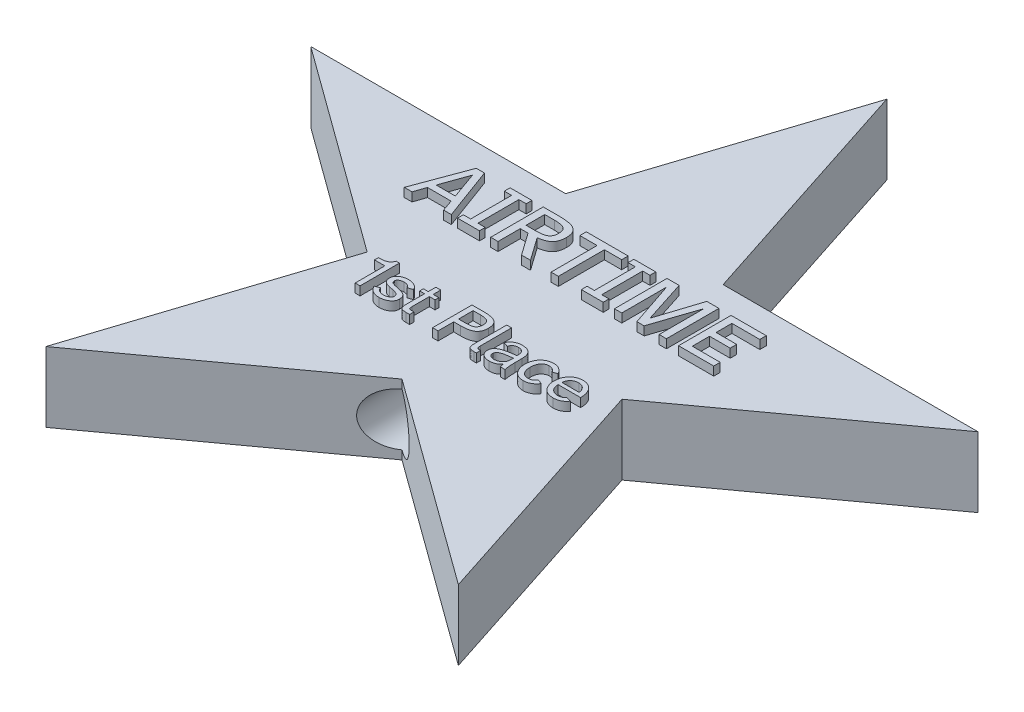
from build123d import *

# Parameters (mm, degrees)
BOSS_EXTRUDE1_DEPTH = 8
BOSS_EXTRUDE2_DEPTH = 1
SKETCH3_R           = 3
CUT_EXTRUDE1_DEPTH  = 9


with BuildPart() as part:
    # Sketch1 → Boss-Extrude1 (new body)
    with BuildSketch(Plane(origin=(0, 0, 0), x_dir=(1, 0, 0), z_dir=(0, 1, 0))):
        Polygon((0, 0), (8.994189943, -27.681270317), (38.1, -27.681270317), (14.552905029, -44.789236225), (23.547094971, -72.470506542), (0, -55.362540634), (-23.547094971, -72.470506542), (-14.552905029, -44.789236225), (-38.1, -27.681270317), (-8.994189943, -27.681270317), align=None)
    extrude(amount=BOSS_EXTRUDE1_DEPTH)

    # Sketch2 → Boss-Extrude2 (add)
    # profile 1 of 15: a face of its own
    with BuildSketch(Plane(origin=(0, 8, 0), x_dir=(1, 0, 0), z_dir=(0, 1, 0))):
        with BuildLine():
            Line((-11.174829705, -49.535377091), (-11.174829705, -46.144966133))
            Line((-11.174829705, -46.144966133), (-12.360510355, -46.144966133))
            Line((-12.360510355, -46.144966133), (-12.360510355, -45.713459283))
            add(Edge.make_bspline(
                [(-12.360510355, -45.713459283), (-12.308161509, -45.713003139), (-12.204976686, -45.712104033), (-12.052986102, -45.702056451), (-11.906478904, -45.68662452), (-11.765564563, -45.666458948), (-11.631775272, -45.63628777), (-11.506452769, -45.59413246), (-11.390850601, -45.538548722), (-11.283941391, -45.471490084), (-11.187453214, -45.388532311), (-11.105415156, -45.287512662), (-11.037799116, -45.168409523), (-11.005647688, -45.08087732), (-10.988935013, -45.035377091)],
                knots=[0, 0, 0, 0, 1.139246389, 2.245568783, 3.313622096, 4.345396522, 5.342144491, 6.294599133, 7.21665216, 8.127783474, 9.034320752, 9.972934293, 10.94630834, 12, 12, 12, 12], degree=3))
            Line((-10.988935013, -45.035377091), (-10.616182444, -45.035377091))
            Line((-10.616182444, -45.035377091), (-10.616182444, -49.535377091))
            Line((-10.616182444, -49.535377091), (-11.174829705, -49.535377091))
        make_face()
    # profile 2 of 15: a face of its own
    with BuildSketch(Plane(origin=(0, 8, 0), x_dir=(1, 0, 0), z_dir=(0, 1, 0))):
        with BuildLine():
            add(Edge.make_bspline(
                [(-8.397967547, -49.597020927), (-8.445544966, -49.59595662), (-8.540373404, -49.593835308), (-8.681933073, -49.575190466), (-8.822674687, -49.548176123), (-8.961055524, -49.507217459), (-9.095363811, -49.456304848), (-9.222653937, -49.391562625), (-9.343137054, -49.316920405), (-9.455415797, -49.230105866), (-9.557632527, -49.130699983), (-9.64556909, -49.017172684), (-9.723723301, -48.892893885), (-9.762996216, -48.802345132), (-9.783027479, -48.756160482)],
                knots=[0, 0, 0, 0, 0.994156079, 1.98149189, 2.980552278, 3.987315913, 4.994437444, 5.978963288, 6.967871926, 7.953289602, 8.940488527, 9.939458731, 10.949015058, 12, 12, 12, 12], degree=3))
            Line((-9.783027479, -48.756160482), (-9.243643917, -48.558707571))
            add(Edge.make_bspline(
                [(-9.243643917, -48.558707571), (-9.236950342, -48.581938184), (-9.223834399, -48.627458167), (-9.19823371, -48.692589177), (-9.164855244, -48.751497359), (-9.126859964, -48.805754726), (-9.084865123, -48.856678569), (-9.035325075, -48.900651485), (-8.980498864, -48.93961513), (-8.901427224, -48.98508551), (-8.796367378, -49.03111231), (-8.665939489, -49.070310332), (-8.532848753, -49.095918063), (-8.443031432, -49.098647878), (-8.397967547, -49.100017502)],
                knots=[0, 0, 0, 0, 0.801801301, 1.571115721, 2.314867836, 3.041651161, 3.767106742, 4.49855696, 5.231478833, 5.995021649, 7.520806921, 9.023408482, 10.506560037, 12, 12, 12, 12], degree=3))
            add(Edge.make_bspline(
                [(-8.397967547, -49.100017502), (-8.365179397, -49.099321522), (-8.300359145, -49.09794561), (-8.204799055, -49.085660307), (-8.111858483, -49.067872256), (-8.0227671, -49.041568807), (-7.938144426, -49.010071706), (-7.861827577, -48.968839574), (-7.792580455, -48.922646972), (-7.731931545, -48.869995972), (-7.68130817, -48.811976892), (-7.644857469, -48.748255235), (-7.622303576, -48.68028002), (-7.619940082, -48.633362161), (-7.618750938, -48.609756372)],
                knots=[0, 0, 0, 0, 1.166215785, 2.305540319, 3.423586646, 4.529956083, 5.607760748, 6.629936852, 7.609068202, 8.564517993, 9.480277891, 10.334766518, 11.162170873, 12, 12, 12, 12], degree=3))
            add(Edge.make_bspline(
                [(-7.618750938, -48.609756372), (-7.619647922, -48.587905291), (-7.621384889, -48.545591751), (-7.630239684, -48.484412229), (-7.648627119, -48.428877484), (-7.670840897, -48.377117201), (-7.702585731, -48.331373463), (-7.740491335, -48.290875245), (-7.784449257, -48.254239611), (-7.854205752, -48.213853147), (-7.950526905, -48.170341976), (-8.074815573, -48.123917204), (-8.209132304, -48.083146836), (-8.303400156, -48.063241608), (-8.35173467, -48.053035482)],
                knots=[0, 0, 0, 0, 0.777695943, 1.505969746, 2.188414266, 2.85266215, 3.501825056, 4.156187747, 4.821318092, 5.528156684, 7.014512829, 8.575258919, 10.244012182, 12, 12, 12, 12], degree=3))
            Line((-8.35173467, -48.053035482), (-8.811173883, -47.960569728))
            add(Edge.make_bspline(
                [(-8.811173883, -47.960569728), (-8.888751615, -47.941107631), (-9.041162674, -47.902871932), (-9.222201042, -47.830825254), (-9.355879539, -47.761286099), (-9.444468251, -47.696382424), (-9.523563083, -47.622168922), (-9.593785601, -47.537720234), (-9.649413663, -47.438804867), (-9.688604042, -47.325018226), (-9.712954779, -47.196830804), (-9.715327255, -47.106341516), (-9.716567718, -47.059028633)],
                knots=[0, 0, 0, 0, 1.701757288, 3.34331286, 4.135591178, 4.904151441, 5.673198097, 6.440936875, 7.233834425, 8.074989054, 8.99349613, 10, 10, 10, 10], degree=3))
            add(Edge.make_bspline(
                [(-9.716567718, -47.059028633), (-9.714479464, -47.011291211), (-9.710412675, -46.918324559), (-9.674732338, -46.784634236), (-9.615147872, -46.663447387), (-9.532456241, -46.555539903), (-9.431868604, -46.461273457), (-9.318108569, -46.377921799), (-9.191969186, -46.305963185), (-9.053745021, -46.248431749), (-8.907601326, -46.202507894), (-8.756599254, -46.168469477), (-8.601385936, -46.149076847), (-8.496906424, -46.1463445), (-8.444200424, -46.144966133)],
                knots=[0, 0, 0, 0, 0.986082631, 1.920355097, 2.838077393, 3.762503024, 4.716048575, 5.680356002, 6.673746349, 7.712303261, 8.770859532, 9.839079018, 10.909896327, 12, 12, 12, 12], degree=3))
            add(Edge.make_bspline(
                [(-8.444200424, -46.144966133), (-8.379522925, -46.146871377), (-8.251247121, -46.150650076), (-8.061872682, -46.185018833), (-7.878152741, -46.239170974), (-7.730252818, -46.300693438), (-7.618945613, -46.362297764), (-7.53969859, -46.413160816), (-7.468230062, -46.471860723), (-7.402525045, -46.536142163), (-7.344326912, -46.606744582), (-7.290188951, -46.682265789), (-7.244377287, -46.764973637), (-7.219186901, -46.823466008), (-7.206507787, -46.852907057)],
                knots=[0, 0, 0, 0, 1.535739834, 3.04585466, 4.557029019, 6.081700382, 6.839748514, 7.578234075, 8.315773264, 9.033271986, 9.759037792, 10.48716551, 11.238542828, 12, 12, 12, 12], degree=3))
            Line((-7.206507787, -46.852907057), (-7.732406759, -47.041691304))
            add(Edge.make_bspline(
                [(-7.732406759, -47.041691304), (-7.748067318, -47.009065705), (-7.77917335, -46.944262596), (-7.850064158, -46.861790144), (-7.935476276, -46.79193182), (-8.035629122, -46.737740588), (-8.1433185, -46.695190961), (-8.254986817, -46.664026191), (-8.369061968, -46.645088193), (-8.446055984, -46.643010922), (-8.484654191, -46.641969557)],
                knots=[0, 0, 0, 0, 0.960714165, 1.908233609, 2.868947774, 3.887714533, 4.928304077, 5.949546492, 6.972078174, 8, 8, 8, 8], degree=3))
            add(Edge.make_bspline(
                [(-8.484654191, -46.641969557), (-8.525836045, -46.643177094), (-8.607159126, -46.645561653), (-8.726107975, -46.667109928), (-8.838738562, -46.703425197), (-8.927410444, -46.743427447), (-8.991874189, -46.783215457), (-9.034529947, -46.815428573), (-9.070081544, -46.851938754), (-9.098614061, -46.891519387), (-9.122740915, -46.933412224), (-9.138993474, -46.979391259), (-9.148788068, -47.028427225), (-9.149735992, -47.062193435), (-9.150214979, -47.079255516)],
                knots=[0, 0, 0, 0, 1.6769955, 3.311614902, 4.904450013, 6.490609702, 7.260226023, 7.98765938, 8.662998763, 9.327609681, 9.971822468, 10.625659759, 11.305545232, 12, 12, 12, 12], degree=3))
            add(Edge.make_bspline(
                [(-9.150214979, -47.079255516), (-9.148570089, -47.112343042), (-9.145406759, -47.175974522), (-9.110092804, -47.263707372), (-9.052490608, -47.336533385), (-8.972729506, -47.391503021), (-8.878518179, -47.434693886), (-8.774733221, -47.475390257), (-8.66013608, -47.510369135), (-8.579516405, -47.527742034), (-8.537629362, -47.536768359)],
                knots=[0, 0, 0, 0, 0.945115556, 1.817576251, 2.663565628, 3.573872339, 4.566850153, 5.634378768, 6.770909505, 8, 8, 8, 8], degree=3))
            Line((-8.537629362, -47.536768359), (-8.105159328, -47.622491817))
            add(Edge.make_bspline(
                [(-8.105159328, -47.622491817), (-8.01803482, -47.642339291), (-7.846115265, -47.681503572), (-7.639083982, -47.754232983), (-7.48463969, -47.827592604), (-7.379467469, -47.895210969), (-7.286641723, -47.97639112), (-7.202756746, -48.068277214), (-7.133618833, -48.177446702), (-7.087024118, -48.307518109), (-7.058108414, -48.45565078), (-7.054995503, -48.5611283), (-7.053361383, -48.616498667)],
                knots=[0, 0, 0, 0, 1.671257582, 3.29783049, 4.093133794, 4.866324071, 5.628726266, 6.394552882, 7.188016123, 8.028269759, 8.964941289, 10, 10, 10, 10], degree=3))
            add(Edge.make_bspline(
                [(-7.053361383, -48.616498667), (-7.055828454, -48.666469061), (-7.060653683, -48.76420384), (-7.096729837, -48.905146803), (-7.158919366, -49.033991263), (-7.244837043, -49.149214749), (-7.348343565, -49.252290751), (-7.467510598, -49.342247826), (-7.599996138, -49.420797017), (-7.746126764, -49.48459849), (-7.901427486, -49.533533452), (-8.062266509, -49.571121169), (-8.228532457, -49.592133491), (-8.341084729, -49.595380115), (-8.397967547, -49.597020927)],
                knots=[0, 0, 0, 0, 0.972455258, 1.901980206, 2.81077439, 3.74111896, 4.687169997, 5.646249121, 6.641272731, 7.679793655, 8.743508139, 9.808177582, 10.892274379, 12, 12, 12, 12], degree=3))
        make_face()
    # profile 3 of 15: a face of its own
    with BuildSketch(Plane(origin=(0, 8, 0), x_dir=(1, 0, 0), z_dir=(0, 1, 0))):
        with BuildLine():
            add(Edge.make_bspline(
                [(-5.373566862, -49.535377091), (-5.422726649, -49.534860609), (-5.515448484, -49.533886454), (-5.645417548, -49.520979952), (-5.758231056, -49.502793345), (-5.854552986, -49.475752561), (-5.936429833, -49.435975913), (-6.002036623, -49.379092199), (-6.055757056, -49.309031799), (-6.094317977, -49.222154133), (-6.119904839, -49.118058991), (-6.140034152, -48.99603259), (-6.150825604, -48.853631169), (-6.152103104, -48.75232353), (-6.152783472, -48.698369386)],
                knots=[0, 0, 0, 0, 1.288655415, 2.430573876, 3.421670372, 4.282171067, 5.046558095, 5.787205262, 6.538260159, 7.344488368, 8.259451436, 9.343274172, 10.585088262, 12, 12, 12, 12], degree=3))
            Line((-6.152783472, -48.698369386), (-6.152783472, -46.638116817))
            Line((-6.152783472, -46.638116817), (-6.712393917, -46.638116817))
            Line((-6.712393917, -46.638116817), (-6.712393917, -46.206609968))
            Line((-6.712393917, -46.206609968), (-6.152783472, -46.206609968))
            Line((-6.152783472, -46.206609968), (-6.152783472, -45.343596269))
            Line((-6.152783472, -45.343596269), (-5.594136212, -45.343596269))
            Line((-5.594136212, -45.343596269), (-5.594136212, -46.206609968))
            Line((-5.594136212, -46.206609968), (-4.954581417, -46.206609968))
            Line((-4.954581417, -46.206609968), (-4.954581417, -46.638116817))
            Line((-4.954581417, -46.638116817), (-5.594136212, -46.638116817))
            Line((-5.594136212, -46.638116817), (-5.594136212, -48.605903633))
            add(Edge.make_bspline(
                [(-5.594136212, -48.605903633), (-5.593802052, -48.645090701), (-5.593192709, -48.716548766), (-5.583814951, -48.813650986), (-5.569418421, -48.890076315), (-5.548746476, -48.95099612), (-5.506170955, -48.995618141), (-5.440747156, -49.020377936), (-5.355082905, -49.035830419), (-5.290197503, -49.03746507), (-5.254131931, -49.038373667)],
                knots=[0, 0, 0, 0, 1.413881225, 2.57822847, 3.512080928, 4.224200316, 4.863411193, 5.662151756, 6.70054228, 8, 8, 8, 8], degree=3))
            Line((-5.254131931, -49.038373667), (-4.954581417, -49.038373667))
            Line((-4.954581417, -49.038373667), (-4.954581417, -49.535377091))
            Line((-4.954581417, -49.535377091), (-5.373566862, -49.535377091))
        make_face()
    # profile 4 of 15: a face of its own
    with BuildSketch(Plane(origin=(0, 8, 0), x_dir=(1, 0, 0), z_dir=(0, 1, 0))):
        with BuildLine():
            Line((-2.332792033, -49.535377091), (-2.332792033, -45.035377091))
            Line((-2.332792033, -45.035377091), (-0.940989807, -45.035377091))
            add(Edge.make_bspline(
                [(-0.940989807, -45.035377091), (-0.852657021, -45.0365871), (-0.681204875, -45.038935702), (-0.431909405, -45.059454531), (-0.198894621, -45.092603087), (-0.015547823, -45.131779257), (0.12163487, -45.171446467), (0.217439785, -45.207466591), (0.307943729, -45.248303142), (0.392313529, -45.296255462), (0.471859581, -45.34887086), (0.544707738, -45.408976292), (0.612645368, -45.473699491), (0.675129211, -45.544272876), (0.730015761, -45.622932832), (0.778790062, -45.709083068), (0.818639681, -45.804083888), (0.852774432, -45.906663745), (0.878466324, -46.017938511), (0.896497072, -46.137405708), (0.906995016, -46.265176427), (0.908508112, -46.352994335), (0.909288446, -46.398283769)],
                knots=[0, 0, 0, 0, 1.998170982, 3.878409339, 5.654519698, 7.32006789, 8.115304635, 8.882994645, 9.633833201, 10.359115171, 11.076313613, 11.788751224, 12.492583165, 13.197763157, 13.917201874, 14.658706732, 15.43317091, 16.244012003, 17.10205423, 18.013268002, 18.975402947, 20, 20, 20, 20], degree=3))
            add(Edge.make_bspline(
                [(0.909288446, -46.398283769), (0.908500524, -46.442930884), (0.906967723, -46.529786102), (0.896502233, -46.656277228), (0.878462584, -46.774781499), (0.852805, -46.885110616), (0.818456863, -46.986968607), (0.778759696, -47.081677254), (0.73031614, -47.167747996), (0.674813611, -47.245654932), (0.61264048, -47.316098844), (0.545014294, -47.380910698), (0.471532601, -47.43991512), (0.392324252, -47.492584868), (0.308179776, -47.540778066), (0.217165983, -47.58012419), (0.121827197, -47.616738737), (-0.015676182, -47.654646073), (-0.199026755, -47.692159929), (-0.431932123, -47.724691131), (-0.681250418, -47.743857951), (-0.852663859, -47.746397354), (-0.940989807, -47.747705859)],
                knots=[0, 0, 0, 0, 1.013270556, 1.971187542, 2.878081656, 3.73174582, 4.538235693, 5.31514962, 6.058999971, 6.774767557, 7.482178142, 8.188236411, 8.8983439, 9.617810951, 10.345387099, 11.095598754, 11.865717084, 12.661436707, 14.329199759, 16.109899821, 17.995508498, 20, 20, 20, 20], degree=3))
            Line((-0.940989807, -47.747705859), (-1.706721828, -47.747705859))
            Line((-1.706721828, -47.747705859), (-1.706721828, -49.535377091))
            Line((-1.706721828, -49.535377091), (-2.332792033, -49.535377091))
        make_face()
        with BuildLine():
            Line((-1.706721828, -47.192911338), (-0.888014636, -47.192911338))
            add(Edge.make_bspline(
                [(-0.888014636, -47.192911338), (-0.835020209, -47.19249754), (-0.73150695, -47.191689275), (-0.580864581, -47.181339681), (-0.438372178, -47.167461628), (-0.304783655, -47.147137026), (-0.180097088, -47.117068347), (-0.068039487, -47.068502906), (0.030683526, -47.003778439), (0.103069071, -46.937841005), (0.15171886, -46.875197075), (0.183537691, -46.821763235), (0.210724608, -46.762376541), (0.232578124, -46.696755368), (0.24974964, -46.625203946), (0.262521731, -46.547658596), (0.268599641, -46.463876184), (0.269983024, -46.405996104), (0.270696836, -46.376130516)],
                knots=[0, 0, 0, 0, 1.542357721, 3.012665393, 4.393672929, 5.708948697, 6.944364447, 8.11635665, 9.243983313, 10.368157595, 10.94768979, 11.547151626, 12.1744538, 12.845356387, 13.557132473, 14.314626175, 15.130362646, 16, 16, 16, 16], degree=3))
            add(Edge.make_bspline(
                [(0.270696836, -46.376130516), (0.269995661, -46.345621797), (0.268643248, -46.286777226), (0.262429891, -46.201410714), (0.249850192, -46.122556103), (0.232602672, -46.049725154), (0.210496179, -45.982938937), (0.183746793, -45.922101753), (0.152019887, -45.867546037), (0.102375429, -45.804536546), (0.031291487, -45.735830751), (-0.068201275, -45.669572404), (-0.179803393, -45.617793166), (-0.304649585, -45.584801741), (-0.438297345, -45.561832313), (-0.580669379, -45.543995018), (-0.731542441, -45.535045556), (-0.835030029, -45.533282952), (-0.888014636, -45.532380516)],
                knots=[0, 0, 0, 0, 0.880295361, 1.697895032, 2.466835131, 3.181183989, 3.854805901, 4.493322626, 5.095329883, 5.669626875, 6.80276999, 7.930449582, 9.103210027, 10.334696088, 11.642721789, 13.014353096, 14.471378748, 16, 16, 16, 16], degree=3))
            Line((-0.888014636, -45.532380516), (-1.706721828, -45.532380516))
            Line((-1.706721828, -45.532380516), (-1.706721828, -47.192911338))
        make_face(mode=Mode.SUBTRACT)
    # profile 5 of 15: a face of its own
    with BuildSketch(Plane(origin=(0, 8, 0), x_dir=(1, 0, 0), z_dir=(0, 1, 0))):
        with BuildLine():
            add(Edge.make_bspline(
                [(2.413783309, -49.535377091), (2.364623522, -49.534860608), (2.271901689, -49.533886454), (2.141932618, -49.520979953), (2.029119131, -49.502793343), (1.932797138, -49.475752569), (1.850920492, -49.435975889), (1.785312989, -49.379092287), (1.731595305, -49.309031455), (1.69302285, -49.222155602), (1.66756415, -49.118360464), (1.64714728, -48.996377125), (1.636590317, -48.853944436), (1.635268469, -48.752321192), (1.634566699, -48.698369386)],
                knots=[0, 0, 0, 0, 1.288646185, 2.430556468, 3.421645865, 4.282140396, 5.04652195, 5.787163812, 6.53821333, 7.344435764, 8.259392279, 9.33490128, 10.585098396, 12, 12, 12, 12], degree=3))
            Line((1.634566699, -48.698369386), (1.634566699, -45.035377091))
            Line((1.634566699, -45.035377091), (2.19321396, -45.035377091))
            Line((2.19321396, -45.035377091), (2.19321396, -48.605903633))
            add(Edge.make_bspline(
                [(2.19321396, -48.605903633), (2.193474462, -48.645092108), (2.193951835, -48.716905485), (2.204205679, -48.814095083), (2.219940435, -48.890416342), (2.241440731, -48.951569947), (2.285981787, -48.995013367), (2.350676553, -49.020254125), (2.434857729, -49.03581186), (2.498127615, -49.037459729), (2.533218241, -49.038373667)],
                knots=[0, 0, 0, 0, 1.419752706, 2.60171477, 3.530453528, 4.249964349, 4.908071485, 5.710129009, 6.729996026, 8, 8, 8, 8], degree=3))
            Line((2.533218241, -49.038373667), (2.659395467, -49.038373667))
            Line((2.659395467, -49.038373667), (2.659395467, -49.535377091))
            Line((2.659395467, -49.535377091), (2.413783309, -49.535377091))
        make_face()
    # profile 6 of 15: a face of its own
    with BuildSketch(Plane(origin=(0, 8, 0), x_dir=(1, 0, 0), z_dir=(0, 1, 0))):
        with BuildLine():
            add(Edge.make_bspline(
                [(4.162927145, -49.597020927), (4.11180129, -49.595851332), (4.011338911, -49.593553076), (3.863816004, -49.571649682), (3.723067261, -49.536225032), (3.589926273, -49.487106582), (3.466275264, -49.425699215), (3.356726098, -49.347859808), (3.258177036, -49.260611437), (3.174838079, -49.159252089), (3.106275656, -49.046731871), (3.059540206, -48.921129597), (3.029441983, -48.785836145), (3.026139633, -48.691795386), (3.024442556, -48.643467845)],
                knots=[0, 0, 0, 0, 1.104760205, 2.170855402, 3.216345247, 4.237588551, 5.234092185, 6.191157297, 7.134837643, 8.071599606, 9.018007689, 9.969392091, 10.956470702, 12, 12, 12, 12], degree=3))
            add(Edge.make_bspline(
                [(3.024442556, -48.643467845), (3.024953249, -48.611620046), (3.025953792, -48.549224302), (3.040541454, -48.458422935), (3.060693111, -48.372075956), (3.092180842, -48.291921007), (3.131151709, -48.216636007), (3.178244709, -48.146185512), (3.234536803, -48.081148553), (3.30003393, -48.022449784), (3.372751968, -47.967388377), (3.45285935, -47.915749248), (3.539655715, -47.866130248), (3.634399519, -47.82149953), (3.73541402, -47.77879153), (3.843704459, -47.740682673), (3.958668656, -47.704809487), (4.12472548, -47.660914153), (4.347127012, -47.611782053), (4.630621103, -47.5603366), (4.935034566, -47.513654709), (5.145604647, -47.489506448), (5.254215672, -47.477050893)],
                knots=[0, 0, 0, 0, 0.692711089, 1.357149466, 1.998110463, 2.62002875, 3.226669239, 3.841354064, 4.460910029, 5.094392093, 5.7529932, 6.445280785, 7.168508277, 7.928384484, 8.724327543, 9.555801915, 10.427063312, 11.346236688, 13.295126237, 15.38497512, 17.619592573, 20, 20, 20, 20], degree=3))
            add(Edge.make_bspline(
                [(5.254215672, -47.477050893), (5.25463838, -47.442049834), (5.255461204, -47.373918312), (5.24966321, -47.274808638), (5.238129142, -47.181820804), (5.221401736, -47.094931245), (5.196919022, -47.014495453), (5.167359612, -46.94015584), (5.131519548, -46.871793619), (5.089017198, -46.810181304), (5.04087239, -46.754482713), (4.984935221, -46.706663348), (4.922320574, -46.666359304), (4.852679276, -46.633249203), (4.776435977, -46.607306813), (4.693071582, -46.58921058), (4.603048149, -46.578761161), (4.540844781, -46.577252405), (4.508710535, -46.576472982)],
                knots=[0, 0, 0, 0, 1.24604958, 2.425505346, 3.531484011, 4.580707499, 5.571640793, 6.5205364, 7.425660148, 8.313509929, 9.18028214, 10.039558866, 10.924238402, 11.824149428, 12.778537965, 13.785366975, 14.855921082, 16, 16, 16, 16], degree=3))
            add(Edge.make_bspline(
                [(4.508710535, -46.576472982), (4.461054822, -46.577915407), (4.369400745, -46.580689559), (4.238558305, -46.608033113), (4.121186734, -46.653426799), (4.018201947, -46.716532253), (3.930222531, -46.794695859), (3.860971392, -46.889030343), (3.806444004, -46.995480446), (3.786743343, -47.073908108), (3.776689987, -47.113930174)],
                knots=[0, 0, 0, 0, 1.152519454, 2.216588533, 3.218332585, 4.184836951, 5.126004245, 6.047875634, 7.003820228, 8, 8, 8, 8], degree=3))
            Line((3.776689987, -47.113930174), (3.237306425, -46.952115105))
            add(Edge.make_bspline(
                [(3.237306425, -46.952115105), (3.248930811, -46.920728313), (3.271882857, -46.858755916), (3.31587801, -46.771144377), (3.365318701, -46.688067865), (3.421709475, -46.610651314), (3.485103072, -46.538644187), (3.554403174, -46.472300309), (3.630291781, -46.410850355), (3.712840273, -46.355765671), (3.799768461, -46.305552939), (3.891079404, -46.263538443), (3.984714434, -46.226317133), (4.08206353, -46.196752392), (4.182457544, -46.173436938), (4.286156933, -46.157530433), (4.392871602, -46.146049499), (4.465335458, -46.145329908), (4.501968241, -46.144966133)],
                knots=[0, 0, 0, 0, 1.000308446, 1.97508282, 2.926886575, 3.889094973, 4.834825236, 5.792375164, 6.755110418, 7.751123792, 8.757496997, 9.754065614, 10.75437406, 11.768822651, 12.793669623, 13.833963607, 14.904999765, 16, 16, 16, 16], degree=3))
            add(Edge.make_bspline(
                [(4.501968241, -46.144966133), (4.557228337, -46.14575665), (4.664127745, -46.147285889), (4.818729741, -46.162787795), (4.961759858, -46.188575341), (5.093320815, -46.224119808), (5.214081516, -46.268785897), (5.322391856, -46.326144423), (5.419588984, -46.392810473), (5.505921534, -46.469762772), (5.580096027, -46.558589201), (5.645820545, -46.657609164), (5.698937494, -46.769688051), (5.744643497, -46.892240701), (5.779193359, -47.027214265), (5.802036655, -47.173684465), (5.818464793, -47.331563787), (5.819850505, -47.440724196), (5.820568412, -47.497277776)],
                knots=[0, 0, 0, 0, 1.215384048, 2.351132966, 3.413740091, 4.409250824, 5.345891142, 6.240021172, 7.09816395, 7.933445517, 8.775419556, 9.637390759, 10.540845881, 11.497329741, 12.511508236, 13.599539514, 14.7563748, 16, 16, 16, 16], degree=3))
            Line((5.820568412, -47.497277776), (5.820568412, -48.277457571))
            add(Edge.make_bspline(
                [(5.820568412, -48.277457571), (5.820775185, -48.344568968), (5.821174006, -48.474012841), (5.828782801, -48.661188814), (5.837294917, -48.834405713), (5.852328736, -48.994276188), (5.869735012, -49.142276814), (5.889147751, -49.2809869), (5.910042893, -49.411046092), (5.925711958, -49.494952433), (5.933261049, -49.535377091)],
                knots=[0, 0, 0, 0, 1.273099093, 2.455542322, 3.553631773, 4.562808469, 5.501174674, 6.380680364, 7.219839144, 8, 8, 8, 8], degree=3))
            Line((5.933261049, -49.535377091), (5.420846665, -49.535377091))
            Line((5.420846665, -49.535377091), (5.287927145, -49.077864249))
            add(Edge.make_bspline(
                [(5.287927145, -49.077864249), (5.26211268, -49.116651593), (5.210332848, -49.194453019), (5.110948905, -49.29564521), (4.997133533, -49.385152829), (4.867042393, -49.461978571), (4.718592248, -49.522848552), (4.551022076, -49.567124791), (4.363403224, -49.592503006), (4.231713575, -49.595470759), (4.162927145, -49.597020927)],
                knots=[0, 0, 0, 0, 0.859886003, 1.724798591, 2.608395955, 3.531857681, 4.508659207, 5.565641639, 6.728443556, 8, 8, 8, 8], degree=3))
        make_face()
        with BuildLine():
            add(Edge.make_bspline(
                [(4.282362076, -49.165514078), (4.325137456, -49.164528297), (4.410124621, -49.162569723), (4.535417679, -49.143059072), (4.657568043, -49.114695128), (4.775446057, -49.073691703), (4.88664118, -49.017825461), (4.989500115, -48.946720092), (5.078037051, -48.855578986), (5.158971969, -48.751198784), (5.223995244, -48.626046343), (5.269769798, -48.480493944), (5.296140276, -48.314687357), (5.299591562, -48.19761312), (5.301411734, -48.135869386)],
                knots=[0, 0, 0, 0, 0.93323173, 1.854167518, 2.762072884, 3.668813939, 4.571644971, 5.472078185, 6.384087343, 7.334612514, 8.34733117, 9.444626998, 10.652322881, 12, 12, 12, 12], degree=3))
            Line((5.301411734, -48.135869386), (5.301411734, -47.926858256))
            add(Edge.make_bspline(
                [(5.301411734, -47.926858256), (5.219834717, -47.936254689), (5.061980057, -47.954437148), (4.833468384, -47.984645172), (4.621879056, -48.019479941), (4.427567465, -48.056247342), (4.251717901, -48.097446148), (4.096641724, -48.147056582), (3.96181758, -48.20350983), (3.864635318, -48.258731248), (3.798867862, -48.307920827), (3.756893857, -48.346691511), (3.721323073, -48.388574662), (3.692970392, -48.433890019), (3.670651852, -48.481433489), (3.654071998, -48.531794428), (3.644180318, -48.585287255), (3.643270748, -48.621914874), (3.642807282, -48.64057829)],
                knots=[0, 0, 0, 0, 2.025638136, 3.919687576, 5.685239885, 7.314604782, 8.79755246, 10.137514884, 11.326160169, 12.397925292, 12.884209927, 13.349331485, 13.804639824, 14.23531073, 14.664010927, 15.097295504, 15.540031551, 16, 16, 16, 16], degree=3))
            add(Edge.make_bspline(
                [(3.642807282, -48.64057829), (3.644695906, -48.678066278), (3.6483685, -48.750964924), (3.681319671, -48.854523259), (3.735593514, -48.946479224), (3.811246806, -49.025059898), (3.905283568, -49.089508096), (4.017893864, -49.132622322), (4.144739485, -49.16193583), (4.23497786, -49.164282067), (4.282362076, -49.165514078)],
                knots=[0, 0, 0, 0, 0.963859831, 1.874309112, 2.76807097, 3.692541756, 4.663051902, 5.679939487, 6.781735053, 8, 8, 8, 8], degree=3))
        make_face(mode=Mode.SUBTRACT)
    # profile 7 of 15: a face of its own
    with BuildSketch(Plane(origin=(0, 8, 0), x_dir=(1, 0, 0), z_dir=(0, 1, 0))):
        with BuildLine():
            add(Edge.make_bspline(
                [(8.075384336, -49.597020927), (8.036833467, -49.596220468), (7.960550702, -49.594636555), (7.848252995, -49.583900284), (7.739824513, -49.566572601), (7.635083976, -49.542594731), (7.534343161, -49.510865327), (7.437473093, -49.472128536), (7.344740506, -49.426738062), (7.226925764, -49.357686272), (7.090946791, -49.25490659), (6.946616185, -49.11047353), (6.821804367, -48.945736047), (6.718985177, -48.761100619), (6.638457848, -48.558870262), (6.579555123, -48.342165222), (6.544391751, -48.111011305), (6.540259774, -47.952346006), (6.538141186, -47.87099353)],
                knots=[0, 0, 0, 0, 0.712124665, 1.409120977, 2.08192591, 2.739420091, 3.392216002, 4.031012661, 4.664972498, 5.297682606, 6.551513072, 7.801296919, 9.05869946, 10.357185711, 11.693153642, 13.070096562, 14.497750299, 16, 16, 16, 16], degree=3))
            add(Edge.make_bspline(
                [(6.538141186, -47.87099353), (6.540506538, -47.790583189), (6.545139822, -47.633074378), (6.582616629, -47.403589349), (6.643099722, -47.186739166), (6.714791665, -47.016788721), (6.784503913, -46.889489508), (6.841080465, -46.798849022), (6.902876762, -46.713884631), (6.969701384, -46.634258656), (7.04216217, -46.560281723), (7.119045442, -46.490698536), (7.201587229, -46.426809098), (7.289080348, -46.368180065), (7.380941268, -46.315332967), (7.477248716, -46.269633306), (7.577485694, -46.23134262), (7.681619603, -46.19920691), (7.789944559, -46.175444381), (7.901890909, -46.158157663), (8.017702884, -46.147310358), (8.096229784, -46.14575509), (8.136064987, -46.144966133)],
                knots=[0, 0, 0, 0, 1.82495811, 3.574751465, 5.264046762, 6.9267543, 7.748843331, 8.557900086, 9.351136001, 10.132389575, 10.915986457, 11.700599986, 12.485111909, 13.283756085, 14.090312903, 14.889223205, 15.701524919, 16.524776736, 17.361347949, 18.217106262, 19.095571904, 20, 20, 20, 20], degree=3))
            add(Edge.make_bspline(
                [(8.136064987, -46.144966133), (8.172695747, -46.145728752), (8.244506903, -46.147223795), (8.350336954, -46.158343366), (8.452272252, -46.174959475), (8.549986647, -46.200566179), (8.643984424, -46.232015826), (8.73362133, -46.271920132), (8.819715758, -46.318120696), (8.927591625, -46.388595473), (9.051689123, -46.486369852), (9.182703964, -46.617158783), (9.294775093, -46.759219815), (9.352018945, -46.863587313), (9.380499919, -46.915514078)],
                knots=[0, 0, 0, 0, 0.854621606, 1.675405172, 2.480933389, 3.2623028, 4.029938431, 4.791407035, 5.548995755, 6.307510056, 7.79586973, 9.226247024, 10.619953338, 12, 12, 12, 12], degree=3))
            Line((9.380499919, -46.915514078), (8.868085535, -47.101408769))
            add(Edge.make_bspline(
                [(8.868085535, -47.101408769), (8.849180274, -47.067668471), (8.811609334, -47.000615461), (8.737450808, -46.911937086), (8.653588098, -46.831386047), (8.555905826, -46.765068685), (8.450506937, -46.709803184), (8.337455101, -46.669786798), (8.218265804, -46.646348265), (8.136809841, -46.643440327), (8.09561122, -46.641969557)],
                knots=[0, 0, 0, 0, 0.979543633, 1.946673665, 2.920780255, 3.922042035, 4.931492071, 5.933946619, 6.955035989, 8, 8, 8, 8], degree=3))
            add(Edge.make_bspline(
                [(8.09561122, -46.641969557), (8.055019182, -46.643272), (7.974007363, -46.645871359), (7.854902307, -46.672477363), (7.738992499, -46.713204395), (7.627049594, -46.769621177), (7.522808453, -46.844241923), (7.427489302, -46.936101836), (7.345509356, -47.047284973), (7.272079856, -47.174091692), (7.214235136, -47.320310557), (7.173748883, -47.485192788), (7.148539412, -47.668597116), (7.145548704, -47.797061806), (7.143984508, -47.864251235)],
                knots=[0, 0, 0, 0, 0.838591305, 1.673623936, 2.511820579, 3.376239851, 4.257240337, 5.154417335, 6.102914655, 7.105543612, 8.178609651, 9.343330085, 10.610512073, 12, 12, 12, 12], degree=3))
            add(Edge.make_bspline(
                [(7.143984508, -47.864251235), (7.145581804, -47.930476262), (7.148649298, -48.057656759), (7.173757695, -48.240165997), (7.21521741, -48.406145036), (7.275521183, -48.554261719), (7.348580767, -48.684908892), (7.432719135, -48.797435812), (7.526113217, -48.892896929), (7.629482898, -48.969132477), (7.740342819, -49.027173537), (7.855419963, -49.068613325), (7.974356424, -49.094949619), (8.055023596, -49.098321129), (8.09561122, -49.100017502)],
                knots=[0, 0, 0, 0, 1.364442367, 2.620315426, 3.788714088, 4.881112469, 5.906265165, 6.865758345, 7.768829624, 8.648941348, 9.501404474, 10.338682235, 11.164109264, 12, 12, 12, 12], degree=3))
            add(Edge.make_bspline(
                [(8.09561122, -49.100017502), (8.139715753, -49.098658777), (8.225674231, -49.096010661), (8.349886403, -49.071882201), (8.466231918, -49.035023287), (8.571817028, -48.980336033), (8.66689808, -48.914753498), (8.751375089, -48.841504882), (8.824010601, -48.760050978), (8.862441377, -48.699575324), (8.881570124, -48.669473838)],
                knots=[0, 0, 0, 0, 1.126435162, 2.19539003, 3.223281283, 4.236450363, 5.222285643, 6.170498271, 7.0893737, 8, 8, 8, 8], degree=3))
            Line((8.881570124, -48.669473838), (9.393984508, -48.85536853))
            add(Edge.make_bspline(
                [(9.393984508, -48.85536853), (9.361007011, -48.907420616), (9.294748598, -49.01200371), (9.169099481, -49.152060827), (9.024585476, -49.278638842), (8.890184258, -49.371889668), (8.774260921, -49.437562977), (8.682634159, -49.47915254), (8.58923873, -49.516741737), (8.491938947, -49.545094811), (8.392026082, -49.568627064), (8.288927233, -49.584287002), (8.183207307, -49.595998701), (8.111698641, -49.596676646), (8.075384336, -49.597020927)],
                knots=[0, 0, 0, 0, 1.39867842, 2.810225798, 4.258150538, 5.758252457, 6.519562872, 7.28363173, 8.04392704, 8.805866839, 9.584812923, 10.375499676, 11.175028677, 12, 12, 12, 12], degree=3))
        make_face()
    # profile 8 of 15: a face of its own
    with BuildSketch(Plane(origin=(0, 8, 0), x_dir=(1, 0, 0), z_dir=(0, 1, 0))):
        with BuildLine():
            add(Edge.make_bspline(
                [(11.484095809, -49.597020927), (11.441695657, -49.596216028), (11.358367473, -49.594634176), (11.235739324, -49.584103261), (11.118324602, -49.565825031), (11.005772239, -49.540509977), (10.897953176, -49.509300715), (10.795201854, -49.469541895), (10.697878199, -49.422029377), (10.605087406, -49.368473192), (10.518956795, -49.307036737), (10.436243977, -49.242627219), (10.359056635, -49.172321396), (10.288162726, -49.096141575), (10.222215223, -49.015706529), (10.161203208, -48.930574193), (10.105428349, -48.840194196), (10.038473032, -48.712346747), (9.969455274, -48.542574802), (9.909449829, -48.327141379), (9.873026093, -48.099544865), (9.86897373, -47.943688579), (9.866908309, -47.864251235)],
                knots=[0, 0, 0, 0, 0.953249508, 1.873402478, 2.764647391, 3.622741982, 4.465550792, 5.285929121, 6.096242645, 6.898478357, 7.691470699, 8.472713376, 9.254456091, 10.035798802, 10.810309823, 11.591519152, 12.38880355, 13.19599248, 14.834015866, 16.497792739, 18.214983507, 20, 20, 20, 20], degree=3))
            add(Edge.make_bspline(
                [(9.866908309, -47.864251235), (9.86725497, -47.820879834), (9.867936563, -47.735604477), (9.879518678, -47.609974049), (9.895231737, -47.488635302), (9.918436211, -47.371847336), (9.948190521, -47.259820885), (9.985057421, -47.152401179), (10.028160134, -47.049245133), (10.094681525, -46.919575061), (10.190433358, -46.768833983), (10.325943386, -46.607510812), (10.480931293, -46.468723937), (10.623775728, -46.370521554), (10.746683245, -46.30627327), (10.841169178, -46.261701186), (10.939685656, -46.227098661), (11.040356463, -46.196422795), (11.144103267, -46.173606366), (11.25063432, -46.157573985), (11.359593808, -46.146048389), (11.433337234, -46.145329499), (11.47061122, -46.144966133)],
                knots=[0, 0, 0, 0, 0.98625366, 1.939137998, 2.867752597, 3.76872642, 4.645697157, 5.502608242, 6.350413145, 7.186624132, 8.815612582, 10.401659872, 11.963541993, 13.535552219, 14.329517059, 15.117140872, 15.909626189, 16.702246123, 17.510296359, 18.323249998, 19.15247829, 20, 20, 20, 20], degree=3))
            add(Edge.make_bspline(
                [(11.47061122, -46.144966133), (11.53429062, -46.146740392), (11.658486031, -46.150200771), (11.838786704, -46.179311607), (12.007358217, -46.228689864), (12.163292753, -46.297639149), (12.307672435, -46.38134667), (12.438105304, -46.48060387), (12.556802463, -46.591879766), (12.661448199, -46.71647741), (12.753392751, -46.851767812), (12.830865559, -46.996880359), (12.897593759, -47.149720991), (12.947511878, -47.311202942), (12.984950291, -47.477737164), (13.00987968, -47.647691718), (13.017222462, -47.82061659), (13.011629131, -47.936187617), (13.008817556, -47.994281201)],
                knots=[0, 0, 0, 0, 1.122687335, 2.189603157, 3.210971704, 4.21260448, 5.189683899, 6.147856034, 7.097286461, 8.053666351, 9.011771547, 9.97714583, 10.951233964, 11.948824518, 12.953095174, 13.95977383, 14.974448421, 16, 16, 16, 16], degree=3))
            Line((13.008817556, -47.994281201), (10.466009336, -47.994281201))
            add(Edge.make_bspline(
                [(10.466009336, -47.994281201), (10.467556703, -48.028341875), (10.470584795, -48.094996325), (10.481390245, -48.1920841), (10.496159061, -48.283975251), (10.518044954, -48.36990656), (10.542564848, -48.45092293), (10.572215138, -48.526631255), (10.608165049, -48.59585519), (10.660260988, -48.679792301), (10.733599466, -48.772736493), (10.831610514, -48.867539945), (10.935980585, -48.947006876), (11.049639499, -49.003032436), (11.162846263, -49.046209614), (11.273764907, -49.075574711), (11.379890452, -49.097001408), (11.4499644, -49.099029611), (11.484095809, -49.100017502)],
                knots=[0, 0, 0, 0, 0.973422644, 1.904922694, 2.788202581, 3.628764699, 4.43497228, 5.20453045, 5.946730602, 6.659110314, 8.023747586, 9.314040696, 10.546316488, 11.751868333, 12.918330676, 14.001501601, 15.026577356, 16, 16, 16, 16], degree=3))
            add(Edge.make_bspline(
                [(11.484095809, -49.100017502), (11.529113255, -49.09903652), (11.615656363, -49.097150644), (11.739510714, -49.079293532), (11.85237198, -49.052277426), (11.953606553, -49.012010102), (12.044171211, -48.962972055), (12.124768369, -48.906229809), (12.197519203, -48.844350153), (12.237026167, -48.795658855), (12.256570124, -48.771571441)],
                knots=[0, 0, 0, 0, 1.24025535, 2.384310159, 3.442605918, 4.432041404, 5.37858508, 6.27479568, 7.146547474, 8, 8, 8, 8], degree=3))
            Line((12.256570124, -48.771571441), (12.795953686, -48.932423324))
            add(Edge.make_bspline(
                [(12.795953686, -48.932423324), (12.764144706, -48.979322816), (12.699778173, -49.074225502), (12.57855863, -49.199879477), (12.439531037, -49.313675717), (12.309617655, -49.395629931), (12.198081156, -49.455244586), (12.107884504, -49.491893062), (12.014460425, -49.525654988), (11.915839329, -49.550625425), (11.813849453, -49.572603336), (11.707537522, -49.586429947), (11.597269038, -49.59548263), (11.522321501, -49.596501348), (11.484095809, -49.597020927)],
                knots=[0, 0, 0, 0, 1.325189563, 2.681565316, 4.070910952, 5.524829096, 6.271500848, 7.029819504, 7.802724323, 8.596133772, 9.41019125, 10.244995647, 11.104890453, 12, 12, 12, 12], degree=3))
        make_face()
        with BuildLine():
            Line((10.472751631, -47.562774352), (12.416458823, -47.562774352))
            add(Edge.make_bspline(
                [(12.416458823, -47.562774352), (12.414806452, -47.52480257), (12.411504549, -47.448924212), (12.390026427, -47.336328969), (12.352823376, -47.22677677), (12.301532443, -47.120795978), (12.237854403, -47.020631944), (12.161605926, -46.928585009), (12.073376857, -46.846658773), (11.974439979, -46.774085676), (11.863983657, -46.714587285), (11.74219286, -46.672087853), (11.609708434, -46.646795867), (11.517920547, -46.643611067), (11.47061122, -46.641969557)],
                knots=[0, 0, 0, 0, 0.931359489, 1.861119619, 2.799939786, 3.76147189, 4.742319245, 5.704205998, 6.684800427, 7.688150075, 8.706316339, 9.74986848, 10.840236843, 12, 12, 12, 12], degree=3))
            add(Edge.make_bspline(
                [(11.47061122, -46.641969557), (11.43009402, -46.643049006), (11.349966068, -46.645183753), (11.231529664, -46.663194125), (11.116377283, -46.692204429), (11.004879203, -46.73211447), (10.899322715, -46.784687538), (10.802728819, -46.85223613), (10.715337453, -46.933551664), (10.639002725, -47.030024802), (10.573227685, -47.14042414), (10.524983556, -47.268040911), (10.488621959, -47.409839272), (10.478171926, -47.510541455), (10.472751631, -47.562774352)],
                knots=[0, 0, 0, 0, 0.96114681, 1.90079092, 2.835882719, 3.775897472, 4.706165087, 5.625635708, 6.563672002, 7.528737078, 8.536272126, 9.60030681, 10.755310725, 12, 12, 12, 12], degree=3))
        make_face(mode=Mode.SUBTRACT)
    # profile 9 of 15: a face of its own
    with BuildSketch(Plane(origin=(0, 8, 0), x_dir=(1, 0, 0), z_dir=(0, 1, 0))):
        Polygon((-17.833539652, -37.272851583), (-15.605371844, -31.272851583), (-14.67300883, -31.272851583), (-12.453830748, -37.272851583), (-13.341245132, -37.272851583), (-13.794584173, -35.95778309), (-16.492786228, -35.95778309), (-16.946125269, -37.272851583), align=None)
        Polygon((-16.235936913, -35.218057063), (-14.051433488, -35.218057063), (-15.144327324, -32.156413227), align=None, mode=Mode.SUBTRACT)
    # profile 10 of 15: a face of its own
    with BuildSketch(Plane(origin=(0, 8, 0), x_dir=(1, 0, 0), z_dir=(0, 1, 0))):
        Polygon((-11.747495132, -37.272851583), (-11.747495132, -36.61018035), (-10.912734858, -36.61018035), (-10.912734858, -31.935522816), (-11.747495132, -31.935522816), (-11.747495132, -31.272851583), (-9.244498556, -31.272851583), (-9.244498556, -31.935522816), (-10.077974584, -31.935522816), (-10.077974584, -36.61018035), (-9.244498556, -36.61018035), (-9.244498556, -37.272851583), align=None)
    # profile 11 of 15: a face of its own
    with BuildSketch(Plane(origin=(0, 8, 0), x_dir=(1, 0, 0), z_dir=(0, 1, 0))):
        with BuildLine():
            Line((-7.960251981, -37.272851583), (-7.960251981, -31.272851583))
            Line((-7.960251981, -31.272851583), (-6.077546502, -31.272851583))
            add(Edge.make_bspline(
                [(-6.077546502, -31.272851583), (-5.959781967, -31.274154578), (-5.731260053, -31.276683037), (-5.399341993, -31.301170346), (-5.089378126, -31.342227623), (-4.845236146, -31.388688909), (-4.66214615, -31.436314886), (-4.534377337, -31.480450115), (-4.413786606, -31.531109538), (-4.301084246, -31.590938587), (-4.19605845, -31.657693056), (-4.097146433, -31.730847002), (-4.007798127, -31.813548979), (-3.924587419, -31.902645409), (-3.848982141, -32.000569342), (-3.784990731, -32.110460556), (-3.731109972, -32.231201598), (-3.685610829, -32.362018681), (-3.653830934, -32.504467577), (-3.626817184, -32.656379934), (-3.613787756, -32.819714999), (-3.611622653, -32.932082527), (-3.61050883, -32.989889254)],
                knots=[0, 0, 0, 0, 2.03791432, 3.954569877, 5.755770106, 7.447062723, 8.252174991, 9.027699832, 9.78456221, 10.513683358, 11.233065528, 11.936904788, 12.639612315, 13.336869832, 14.045179192, 14.775804459, 15.531832349, 16.330785047, 17.168212771, 18.054923653, 18.999368422, 20, 20, 20, 20], degree=3))
            add(Edge.make_bspline(
                [(-3.61050883, -32.989889254), (-3.611994879, -33.0558719), (-3.614928082, -33.186110301), (-3.638059333, -33.378406456), (-3.679016144, -33.563540097), (-3.730636165, -33.742866144), (-3.806512456, -33.912787501), (-3.912529261, -34.069121356), (-4.047944461, -34.210474383), (-4.18109086, -34.316167938), (-4.303018088, -34.392409683), (-4.406954883, -34.446059892), (-4.522205301, -34.494794144), (-4.647993239, -34.539295305), (-4.78413476, -34.580565496), (-4.930802228, -34.616253543), (-5.08815108, -34.647014153), (-5.196914839, -34.663659638), (-5.2530602, -34.672252268)],
                knots=[0, 0, 0, 0, 1.198659451, 2.365947721, 3.511580856, 4.640941174, 5.751287516, 6.877322078, 8.054697941, 9.294877997, 9.955241761, 10.664881362, 11.417542707, 12.226899281, 13.088073374, 14.001072434, 14.968125857, 16, 16, 16, 16], degree=3))
            Line((-5.2530602, -34.672252268), (-3.415303351, -37.272851583))
            Line((-3.415303351, -37.272851583), (-4.436279378, -37.272851583))
            Line((-4.436279378, -37.272851583), (-6.238077324, -34.730043364))
            Line((-6.238077324, -34.730043364), (-7.125491707, -34.730043364))
            Line((-7.125491707, -34.730043364), (-7.125491707, -37.272851583))
            Line((-7.125491707, -37.272851583), (-7.960251981, -37.272851583))
        make_face()
        with BuildLine():
            Line((-7.125491707, -34.067372131), (-6.015902666, -34.067372131))
            add(Edge.make_bspline(
                [(-6.015902666, -34.067372131), (-5.945243564, -34.066811171), (-5.806798838, -34.065712063), (-5.60509036, -34.051944889), (-5.413383644, -34.0333774), (-5.23321321, -34.006199001), (-5.064922343, -33.966891955), (-4.91517132, -33.900840113), (-4.78193105, -33.817240805), (-4.68654448, -33.729466188), (-4.62015505, -33.648873385), (-4.578592233, -33.579170666), (-4.541822339, -33.50242772), (-4.513014385, -33.417783452), (-4.48983352, -33.325889913), (-4.472860246, -33.22631603), (-4.464790114, -33.118874286), (-4.46292333, -33.044693323), (-4.46196431, -33.00658446)],
                knots=[0, 0, 0, 0, 1.554581989, 3.045944102, 4.447268907, 5.791581052, 7.055040846, 8.23632191, 9.375693103, 10.502376375, 11.071730867, 11.667885845, 12.283087412, 12.941487984, 13.631477955, 14.367094731, 15.161130298, 16, 16, 16, 16], degree=3))
            add(Edge.make_bspline(
                [(-4.46196431, -33.00658446), (-4.462915501, -32.967619654), (-4.464757692, -32.89215577), (-4.472854363, -32.783003183), (-4.489881205, -32.682168815), (-4.512779461, -32.589324182), (-4.541910603, -32.504367874), (-4.578195903, -32.427759312), (-4.620589105, -32.359005991), (-4.686166417, -32.27863965), (-4.782074782, -32.192036819), (-4.915499695, -32.109865662), (-5.065058022, -32.043839289), (-5.233250338, -32.003317853), (-5.413300595, -31.973315043), (-5.604984352, -31.951915567), (-5.806759027, -31.93692642), (-5.945239705, -31.935997049), (-6.015902666, -31.935522816)],
                knots=[0, 0, 0, 0, 0.855813216, 1.657469815, 2.400738674, 3.098326173, 3.75527873, 4.36912729, 4.955971253, 5.524073568, 6.641934678, 7.773776467, 8.95245955, 10.215486148, 11.55986817, 12.960131546, 14.448836989, 16, 16, 16, 16], degree=3))
            Line((-6.015902666, -31.935522816), (-7.125491707, -31.935522816))
            Line((-7.125491707, -31.935522816), (-7.125491707, -34.067372131))
        make_face(mode=Mode.SUBTRACT)
    # profile 12 of 15: a face of its own
    with BuildSketch(Plane(origin=(0, 8, 0), x_dir=(1, 0, 0), z_dir=(0, 1, 0))):
        Polygon((-1.067700611, -37.272851583), (-1.067700611, -32.01257761), (-3.039019104, -32.01257761), (-3.039019104, -31.272851583), (1.737093909, -31.272851583), (1.737093909, -32.01257761), (-0.234224584, -32.01257761), (-0.234224584, -37.272851583), align=None)
    # profile 13 of 15: a face of its own
    with BuildSketch(Plane(origin=(0, 8, 0), x_dir=(1, 0, 0), z_dir=(0, 1, 0))):
        Polygon((2.38949117, -37.272851583), (2.38949117, -36.61018035), (3.224251444, -36.61018035), (3.224251444, -31.935522816), (2.38949117, -31.935522816), (2.38949117, -31.272851583), (4.892487745, -31.272851583), (4.892487745, -31.935522816), (4.059011718, -31.935522816), (4.059011718, -36.61018035), (4.892487745, -36.61018035), (4.892487745, -37.272851583), align=None)
    # profile 14 of 15: a face of its own
    with BuildSketch(Plane(origin=(0, 8, 0), x_dir=(1, 0, 0), z_dir=(0, 1, 0))):
        Polygon((6.17673432, -37.272851583), (6.17673432, -31.272851583), (7.562436375, -31.272851583), (9.142059663, -36.179957747), (10.72168295, -31.272851583), (12.107385005, -31.272851583), (12.107385005, -37.272851583), (11.272624731, -37.272851583), (11.272624731, -32.161550213), (9.5594398, -37.272851583), (8.733669252, -37.272851583), (7.011494594, -32.161550213), (7.011494594, -37.272851583), align=None)
    # profile 15 of 15: a face of its own
    with BuildSketch(Plane(origin=(0, 8, 0), x_dir=(1, 0, 0), z_dir=(0, 1, 0))):
        Polygon((13.491802813, -37.272851583), (13.491802813, -31.272851583), (17.512778841, -31.272851583), (17.512778841, -32.01257761), (14.326563087, -32.01257761), (14.326563087, -33.820796789), (16.679302813, -33.820796789), (16.679302813, -34.560522816), (14.326563087, -34.560522816), (14.326563087, -36.533125556), (17.512778841, -36.533125556), (17.512778841, -37.272851583), align=None)
    extrude(amount=BOSS_EXTRUDE2_DEPTH)

    # Sketch3 → Cut-Extrude1 (cut)
    with BuildSketch(Plane.XY.offset(60)):
        with Locations((0, 4)):
            Circle(SKETCH3_R)
    extrude(amount=-CUT_EXTRUDE1_DEPTH, mode=Mode.SUBTRACT)


solid = part.part
